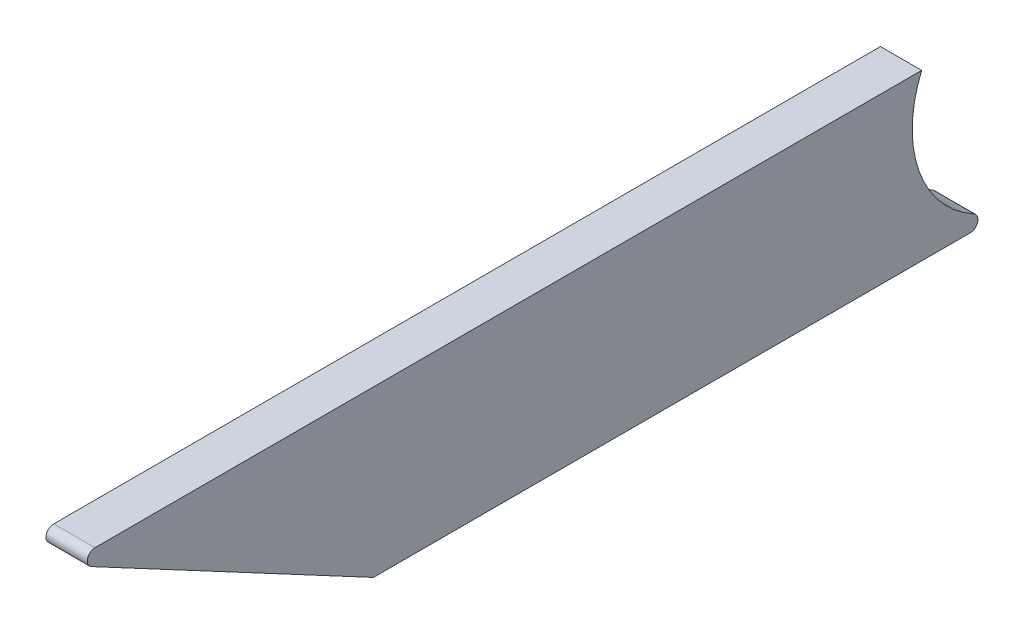
from build123d import *

# Parameters (mm, degrees)
EXTRUDE_1_DEPTH = 16
FILLET_1_R      = 3


with BuildPart() as part:
    # 草图1 → 凸台-拉伸1 (new body)
    with BuildSketch(Plane(origin=(0, 0, 0), x_dir=(0, 0, -1), z_dir=(1, 0, 0))):
        with BuildLine():
            Line((-375, 18), (-42.332020977, 18))
            ThreePointArc((-42.332020977, 18), (-38.366652187, -25.377155081), (0, -46))
            Line((0, -46), (-255, -46))
            Line((-255, -46), (-375, 18))
        make_face()
    extrude(amount=EXTRUDE_1_DEPTH)

    # 圆角1
    fillet_1_edges = [part.edges().sort_by_distance(p)[0] for p in [
        (8, 18, 375),
        (8, -46, 0),
    ]]
    fillet(fillet_1_edges, radius=FILLET_1_R)


solid = part.part
